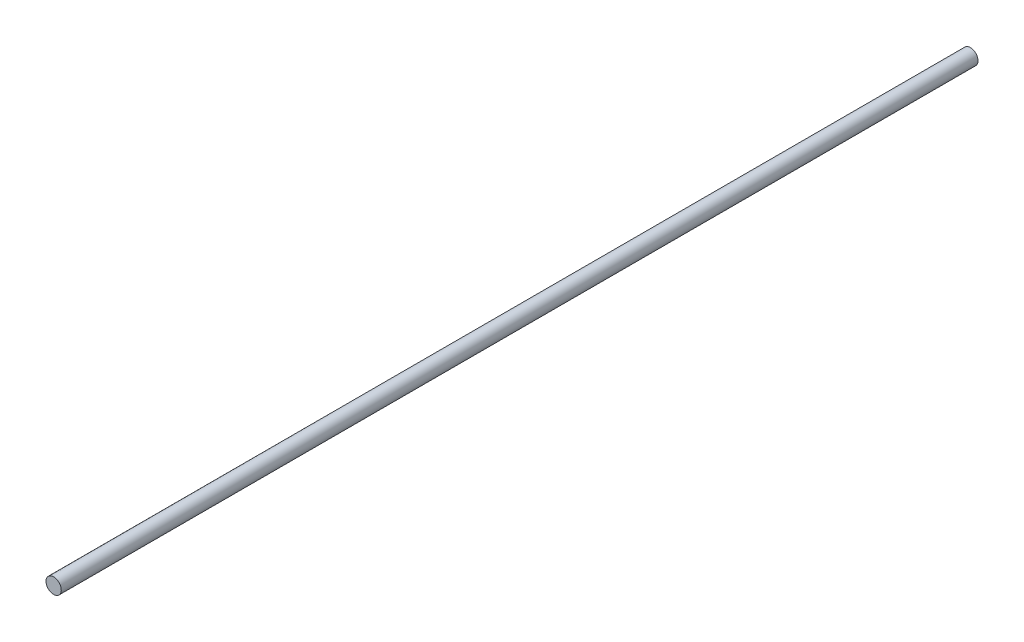
from build123d import *

# Parameters (mm, degrees)
BOSS_EXTRUDE1_DEPTH      = 300
BOSS_EXTRUDE1_DEPTH_BACK = 300
SKETCH3_R                = 5


with BuildPart() as part:
    # Sketch3 → Boss-Extrude1 (new, two sides: drawn at the far end of the back side and taken through both)
    with BuildSketch(Plane.XY.offset(-BOSS_EXTRUDE1_DEPTH_BACK)):
        Circle(SKETCH3_R)
    extrude(amount=BOSS_EXTRUDE1_DEPTH + BOSS_EXTRUDE1_DEPTH_BACK)


solid = part.part
